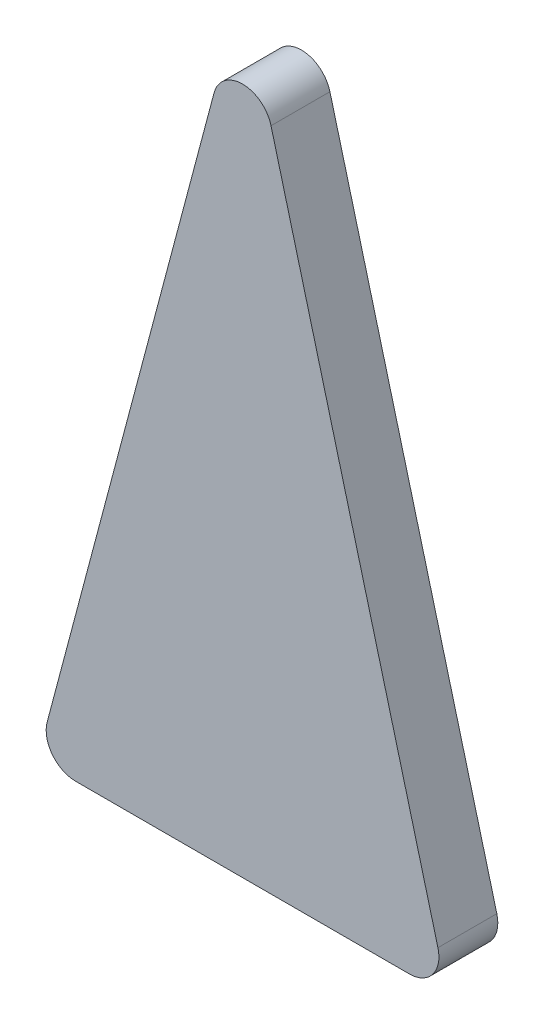
from build123d import *

# Parameters (mm, degrees)
EXTRUDE1_DEPTH = 6


with BuildPart() as part:
    # Sketch1 → Extrude1 (new body)
    with BuildSketch(Plane.XY):
        with BuildLine():
            Line((-17, 0), (17, 0))
            ThreePointArc((17, 0), (19.378077323, 1.171134711), (19.899455381, 3.770167836))
            Line((19.899455381, 3.770167836), (2.899455381, 67.770167836))
            ThreePointArc((2.899455381, 67.770167836), (0, 70), (-2.899455381, 67.770167836))
            Line((-2.899455381, 67.770167836), (-19.899455381, 3.770167836))
            ThreePointArc((-19.899455381, 3.770167836), (-19.378077323, 1.171134711), (-17, 0))
        make_face()
    extrude(amount=EXTRUDE1_DEPTH)


solid = part.part
